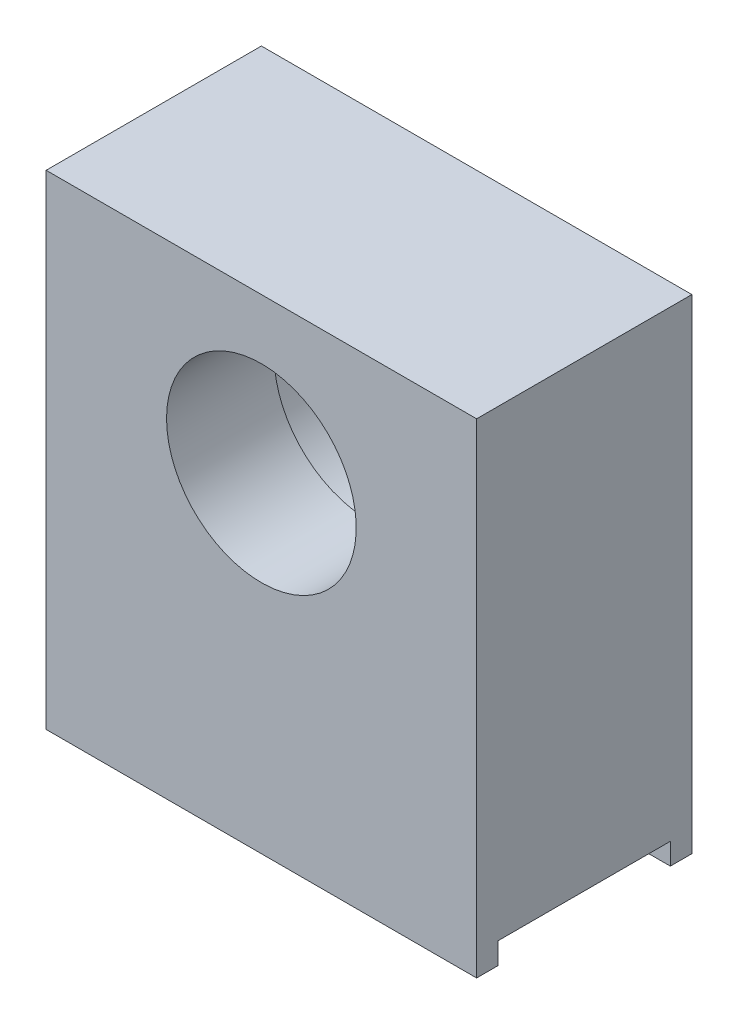
from build123d import *

# Parameters (mm, degrees)
SKETCH1_W           = 32
SKETCH1_H           = 16
BOSS_EXTRUDE1_DEPTH = 36
SKETCH2_W           = 32
SKETCH2_H           = 12.8
CUT_EXTRUDE1_DEPTH  = 1.6
SKETCH3_R           = 7.05
CUT_EXTRUDE2_DEPTH  = 44.036739415
SKETCH4_R           = 7.7
CUT_EXTRUDE3_DEPTH  = 8


with BuildPart() as part:
    # Sketch1 → Boss-Extrude1 (new body)
    with BuildSketch(Plane(origin=(0, 0, 0), x_dir=(1, 0, 0), z_dir=(0, 1, 0))):
        with Locations((1.325153374, -1.104294479)):
            Rectangle(SKETCH1_W, SKETCH1_H)
    extrude(amount=BOSS_EXTRUDE1_DEPTH)

    # Sketch2 → Cut-Extrude1 (cut)
    with BuildSketch(Plane(origin=(0, 0, 0), x_dir=(-1, 0, 0), z_dir=(0, -1, 0))):
        with Locations((-1.325153374, -1.104294479)):
            Rectangle(SKETCH2_W, SKETCH2_H)
    extrude(amount=-CUT_EXTRUDE1_DEPTH, mode=Mode.SUBTRACT)

    # Sketch3 → Cut-Extrude2 (cut, through all)
    with BuildSketch(Plane(origin=(0, 0, -6.895705521), x_dir=(-1, 0, 0), z_dir=(0, 0, -1))):
        with Locations((-1.325153374, 24.5)):
            Circle(SKETCH3_R)
    extrude(amount=-CUT_EXTRUDE2_DEPTH, mode=Mode.SUBTRACT)

    # Sketch4 → Cut-Extrude3 (cut)
    with BuildSketch(Plane(origin=(0, 0, -6.895705521), x_dir=(-1, 0, 0), z_dir=(0, 0, -1))):
        with Locations((-1.325153374, 24.5)):
            Circle(SKETCH4_R)
    extrude(amount=-CUT_EXTRUDE3_DEPTH, mode=Mode.SUBTRACT)


solid = part.part
